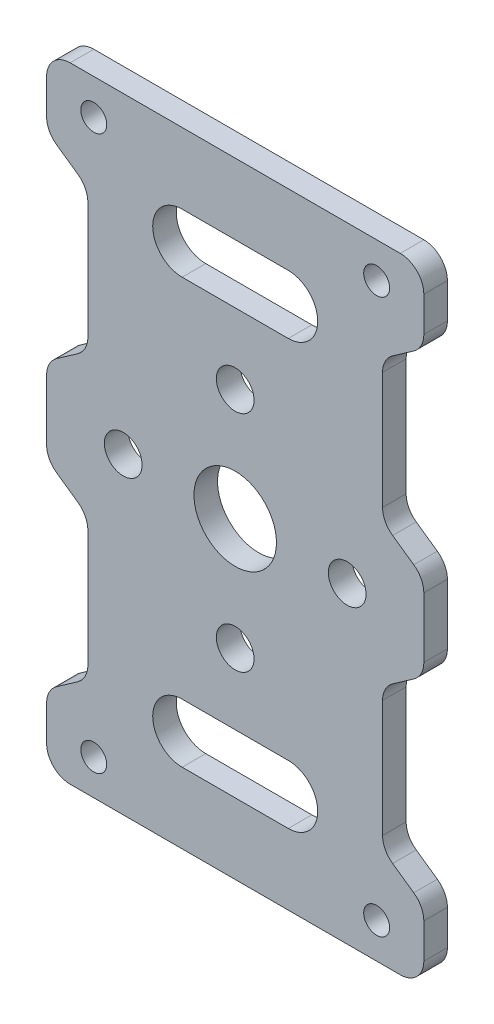
from build123d import *

# Parameters (mm, degrees)
SKETCH1_W               = 32
SKETCH1_H               = 53
SKETCH1_R               = 1.6
SKETCH1_R_2             = 1.1
SKETCH1_R_3             = 3.5
BOSS_EXTRUDE1_DEPTH     = 2
CUT_EXTRUDE1_DEPTH      = 32.020154738
CUT_EXTRUDE1_DEPTH_BACK = 32.020154738
FILLET1_R               = 2


with BuildPart() as part:
    # Sketch1 → Boss-Extrude1 (new body)
    with BuildSketch(Plane.XY):
        Rectangle(SKETCH1_W, SKETCH1_H)
        with Locations((0, 9.5)):
            Circle(SKETCH1_R, mode=Mode.SUBTRACT)
        with Locations((9.5, 0)):
            Circle(SKETCH1_R, mode=Mode.SUBTRACT)
        with Locations((0, -9.5)):
            Circle(SKETCH1_R, mode=Mode.SUBTRACT)
        with Locations((-9.5, 0)):
            Circle(SKETCH1_R, mode=Mode.SUBTRACT)
        with Locations((-12, 23.5)):
            Circle(SKETCH1_R_2, mode=Mode.SUBTRACT)
        with Locations((12, -23.5)):
            Circle(SKETCH1_R_2, mode=Mode.SUBTRACT)
        with Locations((12, 23.5)):
            Circle(SKETCH1_R_2, mode=Mode.SUBTRACT)
        with Locations((-12, -23.5)):
            Circle(SKETCH1_R_2, mode=Mode.SUBTRACT)
        Circle(SKETCH1_R_3, mode=Mode.SUBTRACT)
    extrude(amount=BOSS_EXTRUDE1_DEPTH)

    # Sketch2 → Cut-Extrude1 (cut, two sides: drawn at the far end of the back side and taken through both)
    with BuildSketch(Plane.XY.offset(2).offset(-CUT_EXTRUDE1_DEPTH_BACK)):
        Polygon((-16, 20.5), (-12.5, 18.049273616), (-12.5, 6.049273616), (-16, 3.598547233), align=None)
        Polygon((12.5, 6.049273616), (16, 3.598547233), (16, 20.5), (12.5, 18.049273616), align=None)
        Polygon((16, -20.5), (12.5, -18.049273616), (12.5, -6.049273616), (16, -3.598547233), align=None)
        Polygon((-12.5, -6.049273616), (-16, -3.598547233), (-16, -20.5), (-12.5, -18.049273616), align=None)
        with BuildLine():
            Line((-4.5, 20.5), (4.5, 20.5))
            ThreePointArc((4.5, 20.5), (7, 18), (4.5, 15.5))
            Line((4.5, 15.5), (-4.5, 15.5))
            ThreePointArc((-4.5, 15.5), (-7, 18), (-4.5, 20.5))
        make_face()
        with BuildLine():
            Line((-4.5, -20.5), (4.5, -20.5))
            ThreePointArc((4.5, -20.5), (7, -18), (4.5, -15.5))
            Line((4.5, -15.5), (-4.5, -15.5))
            ThreePointArc((-4.5, -15.5), (-7, -18), (-4.5, -20.5))
        make_face()
    extrude(amount=CUT_EXTRUDE1_DEPTH + CUT_EXTRUDE1_DEPTH_BACK, mode=Mode.SUBTRACT)

    # Fillet1
    fillet1_edges = [part.edges().sort_by_distance(p)[0] for p in [
        (16, -3.598547233, 1),
        (16, -20.5, 1),
        (12.5, -18.049273616, 1),
        (12.5, -6.049273616, 1),
        (-12.5, -6.049273616, 1),
        (-12.5, -18.049273616, 1),
        (-16, -20.5, 1),
        (-16, -3.598547233, 1),
        (-16, 3.598547233, 1),
        (-16, 20.5, 1),
        (-12.5, 18.049273616, 1),
        (-12.5, 6.049273616, 1),
        (16, -26.5, 1),
        (-16, -26.5, 1),
        (-16, 26.5, 1),
        (16, 26.5, 1),
        (12.5, 6.049273616, 1),
        (12.5, 18.049273616, 1),
        (16, 20.5, 1),
        (16, 3.598547233, 1),
    ]]
    fillet(fillet1_edges, radius=FILLET1_R)


solid = part.part
